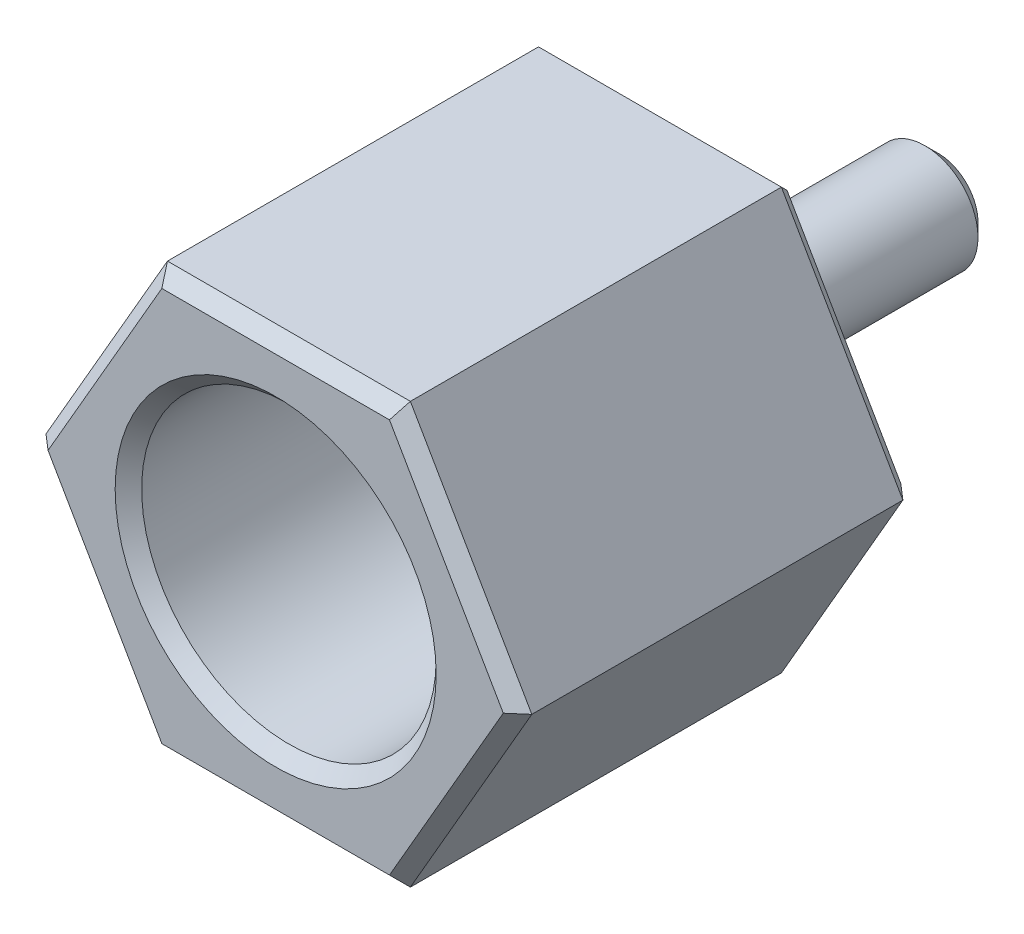
from build123d import *

# Parameters (mm, degrees)
SKETCH2_R           = 5.55625
BOSS_EXTRUDE1_DEPTH = 15
CHAMFER1_SIZE       = 0.5


with BuildPart() as part:
    # Sketch1 → Revolve1 (revolve)
    with BuildSketch(Plane(origin=(0, 0, 0), x_dir=(1, 0, 0), z_dir=(0, 1, 0))):
        Polygon((1, 25), (2, 25), (2, 15), (7.9375, 15), (7.9375, 0), (5.55625, 0), (5.55625, 12), (1, 12), align=None)
    revolve(axis=Axis((0, 0, 0), (0, 0, -1)))

    # Sketch2 → Boss-Extrude1 (add, through all)
    with BuildSketch(Plane(origin=(0, 0, -15), x_dir=(-1, 0, 0), z_dir=(0, 0, -1))):
        Polygon((9.165435523, 0), (4.582717762, 7.9375), (-4.582717762, 7.9375), (-9.165435523, 0), (-4.582717762, -7.9375), (4.582717762, -7.9375), align=None)
        with Locations(Location((0, 0, 0), (0, 0, 180))):
            Circle(SKETCH2_R, mode=Mode.SUBTRACT)
    extrude(amount=-BOSS_EXTRUDE1_DEPTH)

    # Chamfer1
    chamfer1_edges = [part.edges().sort_by_distance(p)[0] for p in [
        (-6.874076643, -3.96875, -15),
        (0, -7.9375, -15),
        (6.874076643, -3.96875, -15),
        (6.874076643, 3.96875, -15),
        (0, 7.9375, -15),
        (-6.874076643, 3.96875, -15),
        (-6.874076643, -3.96875, 0),
        (0, -7.9375, 0),
        (6.874076643, -3.96875, 0),
        (6.874076643, 3.96875, 0),
        (0, 7.9375, 0),
        (-6.874076643, 3.96875, 0),
        (-5.55625, 0, 0),
        (-2, 0, -25),
    ]]
    chamfer(chamfer1_edges, length=CHAMFER1_SIZE)


solid = part.part
